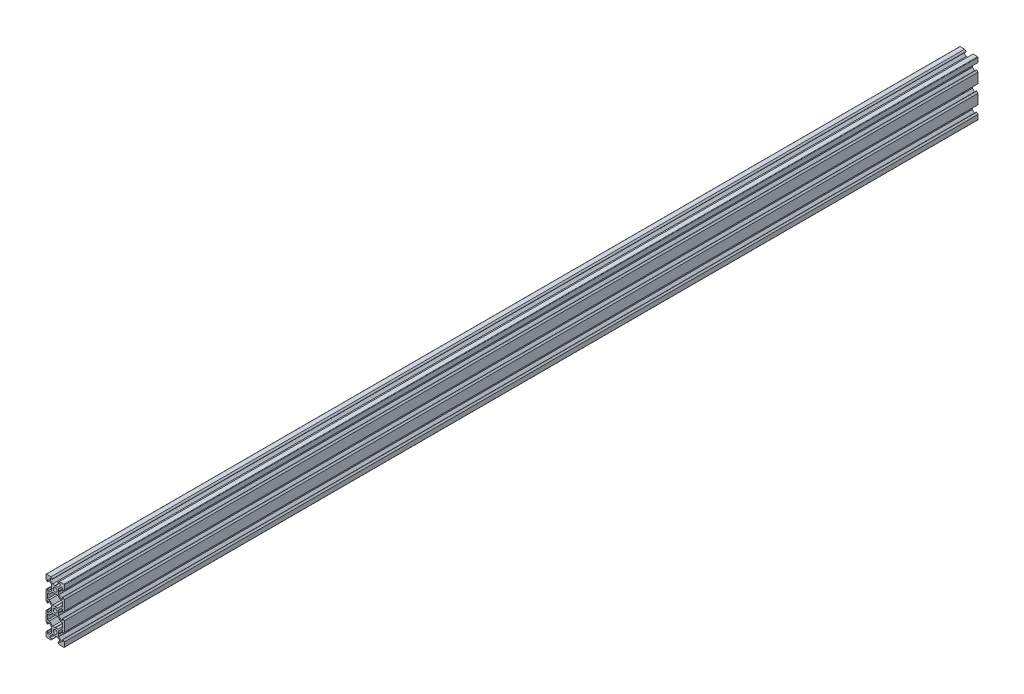
from build123d import *

# Parameters (mm, degrees)
SKETCH2_R           = 2.1
BOSS_EXTRUDE2_DEPTH = 1000
SKETCH3_R           = 2.1
CUT_EXTRUDE1_DEPTH  = 10


with BuildPart() as part:
    # Sketch2 → Boss-Extrude2 (new body)
    with BuildSketch(Plane.XY):
        with BuildLine():
            Line((-9.5, 10), (-4.58, 10))
            Line((-4.58, 10), (-3.13, 8.55))
            Line((-3.13, 8.55), (-3.13, 8.2))
            Line((-3.13, 8.2), (-5.5, 8.2))
            Line((-5.5, 8.2), (-5.5, 6.56))
            Line((-5.5, 6.56), (-2.84, 3.9))
            Line((-2.84, 3.9), (-0.21, 3.9))
            Line((-0.21, 3.9), (0, 3.69))
            Line((0, 3.69), (0.21, 3.9))
            Line((0.21, 3.9), (2.84, 3.9))
            Line((2.84, 3.9), (5.5, 6.56))
            Line((5.5, 6.56), (5.5, 8.2))
            Line((5.5, 8.2), (3.13, 8.2))
            Line((3.13, 8.2), (3.13, 8.55))
            Line((3.13, 8.55), (4.58, 10))
            Line((4.58, 10), (9.5, 10))
            ThreePointArc((9.5, 10), (9.853553391, 9.853553391), (10, 9.5))
            Line((10, 9.5), (10, 4.58))
            Line((10, 4.58), (8.55, 3.13))
            Line((8.55, 3.13), (8.2, 3.13))
            Line((8.2, 3.13), (8.2, 5.5))
            Line((8.2, 5.5), (6.56, 5.5))
            Line((6.56, 5.5), (3.9, 2.84))
            Line((3.9, 2.84), (3.9, 0.21))
            Line((3.9, 0.21), (3.69, 0))
            Line((3.69, 0), (3.9, -0.21))
            Line((3.9, -0.21), (3.9, -2.84))
            Line((3.9, -2.84), (6.56, -5.5))
            Line((6.56, -5.5), (8.2, -5.5))
            Line((8.2, -5.5), (8.2, -3.13))
            Line((8.2, -3.13), (8.55, -3.13))
            Line((8.55, -3.13), (10, -4.58))
            Line((10, -4.58), (10, -10))
            Line((10, -10), (10, -15.42))
            Line((10, -15.42), (8.55, -16.87))
            Line((8.55, -16.87), (8.2, -16.87))
            Line((8.2, -16.87), (8.2, -14.5))
            Line((8.2, -14.5), (6.56, -14.5))
            Line((6.56, -14.5), (3.9, -17.16))
            Line((3.9, -17.16), (3.9, -19.79))
            Line((3.9, -19.79), (3.69, -20))
            Line((3.69, -20), (3.9, -20.21))
            Line((3.9, -20.21), (3.9, -22.84))
            Line((3.9, -22.84), (6.56, -25.5))
            Line((6.56, -25.5), (8.2, -25.5))
            Line((8.2, -25.5), (8.2, -23.13))
            Line((8.2, -23.13), (8.55, -23.13))
            Line((8.55, -23.13), (10, -24.58))
            Line((10, -24.58), (10, -30))
            Line((10, -30), (10, -35.42))
            Line((10, -35.42), (8.55, -36.87))
            Line((8.55, -36.87), (8.2, -36.87))
            Line((8.2, -36.87), (8.2, -34.5))
            Line((8.2, -34.5), (6.56, -34.5))
            Line((6.56, -34.5), (3.9, -37.16))
            Line((3.9, -37.16), (3.9, -39.79))
            Line((3.9, -39.79), (3.69, -40))
            Line((3.69, -40), (3.9, -40.21))
            Line((3.9, -40.21), (3.9, -42.84))
            Line((3.9, -42.84), (6.56, -45.5))
            Line((6.56, -45.5), (8.2, -45.5))
            Line((8.2, -45.5), (8.2, -43.13))
            Line((8.2, -43.13), (8.55, -43.13))
            Line((8.55, -43.13), (10, -44.58))
            Line((10, -44.58), (10, -49.5))
            ThreePointArc((10, -49.5), (9.853553391, -49.853553391), (9.5, -50))
            Line((9.5, -50), (4.58, -50))
            Line((4.58, -50), (3.13, -48.55))
            Line((3.13, -48.55), (3.13, -48.2))
            Line((3.13, -48.2), (5.5, -48.2))
            Line((5.5, -48.2), (5.5, -46.56))
            Line((5.5, -46.56), (2.84, -43.9))
            Line((2.84, -43.9), (0.21, -43.9))
            Line((0.21, -43.9), (0, -43.69))
            Line((0, -43.69), (-0.21, -43.9))
            Line((-0.21, -43.9), (-2.84, -43.9))
            Line((-2.84, -43.9), (-5.5, -46.56))
            Line((-5.5, -46.56), (-5.5, -48.2))
            Line((-5.5, -48.2), (-3.13, -48.2))
            Line((-3.13, -48.2), (-3.13, -48.55))
            Line((-3.13, -48.55), (-4.58, -50))
            Line((-4.58, -50), (-9.5, -50))
            ThreePointArc((-9.5, -50), (-9.853553391, -49.853553391), (-10, -49.5))
            Line((-10, -49.5), (-10, -44.58))
            Line((-10, -44.58), (-8.55, -43.13))
            Line((-8.55, -43.13), (-8.2, -43.13))
            Line((-8.2, -43.13), (-8.2, -45.5))
            Line((-8.2, -45.5), (-6.56, -45.5))
            Line((-6.56, -45.5), (-3.9, -42.84))
            Line((-3.9, -42.84), (-3.9, -40.21))
            Line((-3.9, -40.21), (-3.69, -40))
            Line((-3.69, -40), (-3.9, -39.79))
            Line((-3.9, -39.79), (-3.9, -37.16))
            Line((-3.9, -37.16), (-6.56, -34.5))
            Line((-6.56, -34.5), (-8.2, -34.5))
            Line((-8.2, -34.5), (-8.2, -36.87))
            Line((-8.2, -36.87), (-8.55, -36.87))
            Line((-8.55, -36.87), (-10, -35.42))
            Line((-10, -35.42), (-10, -30))
            Line((-10, -30), (-10, -24.58))
            Line((-10, -24.58), (-8.55, -23.13))
            Line((-8.55, -23.13), (-8.2, -23.13))
            Line((-8.2, -23.13), (-8.2, -25.5))
            Line((-8.2, -25.5), (-6.56, -25.5))
            Line((-6.56, -25.5), (-3.9, -22.84))
            Line((-3.9, -22.84), (-3.9, -20.21))
            Line((-3.9, -20.21), (-3.69, -20))
            Line((-3.69, -20), (-3.9, -19.79))
            Line((-3.9, -19.79), (-3.9, -17.16))
            Line((-3.9, -17.16), (-6.56, -14.5))
            Line((-6.56, -14.5), (-8.2, -14.5))
            Line((-8.2, -14.5), (-8.2, -16.87))
            Line((-8.2, -16.87), (-8.55, -16.87))
            Line((-8.55, -16.87), (-10, -15.42))
            Line((-10, -15.42), (-10, -10))
            Line((-10, -10), (-10, -4.58))
            Line((-10, -4.58), (-8.55, -3.13))
            Line((-8.55, -3.13), (-8.2, -3.13))
            Line((-8.2, -3.13), (-8.2, -5.5))
            Line((-8.2, -5.5), (-6.56, -5.5))
            Line((-6.56, -5.5), (-3.9, -2.84))
            Line((-3.9, -2.84), (-3.9, -0.21))
            Line((-3.9, -0.21), (-3.69, 0))
            Line((-3.69, 0), (-3.9, 0.21))
            Line((-3.9, 0.21), (-3.9, 2.84))
            Line((-3.9, 2.84), (-6.56, 5.5))
            Line((-6.56, 5.5), (-8.2, 5.5))
            Line((-8.2, 5.5), (-8.2, 3.13))
            Line((-8.2, 3.13), (-8.55, 3.13))
            Line((-8.55, 3.13), (-10, 4.58))
            Line((-10, 4.58), (-10, 9.5))
            ThreePointArc((-10, 9.5), (-9.853553391, 9.853553391), (-9.5, 10))
        make_face()
        with Locations((0, -20)):
            Circle(SKETCH2_R, mode=Mode.SUBTRACT)
        Circle(SKETCH2_R, mode=Mode.SUBTRACT)
        with Locations((0, -40)):
            Circle(SKETCH2_R, mode=Mode.SUBTRACT)
        Polygon((0.21, -3.9), (0, -3.69), (-0.21, -3.9), (-2.84, -3.9), (-6.24, -7.3), (-8.2, -7.3), (-8.2, -12.7), (-6.24, -12.7), (-2.84, -16.1), (-0.21, -16.1), (0, -16.31), (0.21, -16.1), (2.84, -16.1), (6.24, -12.7), (8.2, -12.7), (8.2, -10), (8.2, -7.3), (6.24, -7.3), (2.84, -3.9), align=None, mode=Mode.SUBTRACT)
        Polygon((-0.21, -36.1), (0, -36.31), (0.21, -36.1), (2.84, -36.1), (6.24, -32.7), (8.2, -32.7), (8.2, -30), (8.2, -27.3), (6.24, -27.3), (2.84, -23.9), (0.21, -23.9), (0, -23.69), (-0.21, -23.9), (-2.84, -23.9), (-6.24, -27.3), (-8.2, -27.3), (-8.2, -32.7), (-6.24, -32.7), (-2.84, -36.1), align=None, mode=Mode.SUBTRACT)
    extrude(amount=-BOSS_EXTRUDE2_DEPTH)

    # Sketch3 → Cut-Extrude1 (cut)
    with BuildSketch(Plane.ZY.offset(3.9)):
        with Locations((-10, -20)):
            Circle(SKETCH3_R)
        with Locations((-10, -40)):
            Circle(SKETCH3_R)
        with Locations((-10, 0)):
            Circle(SKETCH3_R)
        with Locations((-990, 0)):
            Circle(SKETCH3_R)
        with Locations((-990, -40)):
            Circle(SKETCH3_R)
        with Locations((-990, -20)):
            Circle(SKETCH3_R)
    extrude(amount=-CUT_EXTRUDE1_DEPTH, mode=Mode.SUBTRACT)


solid = part.part
